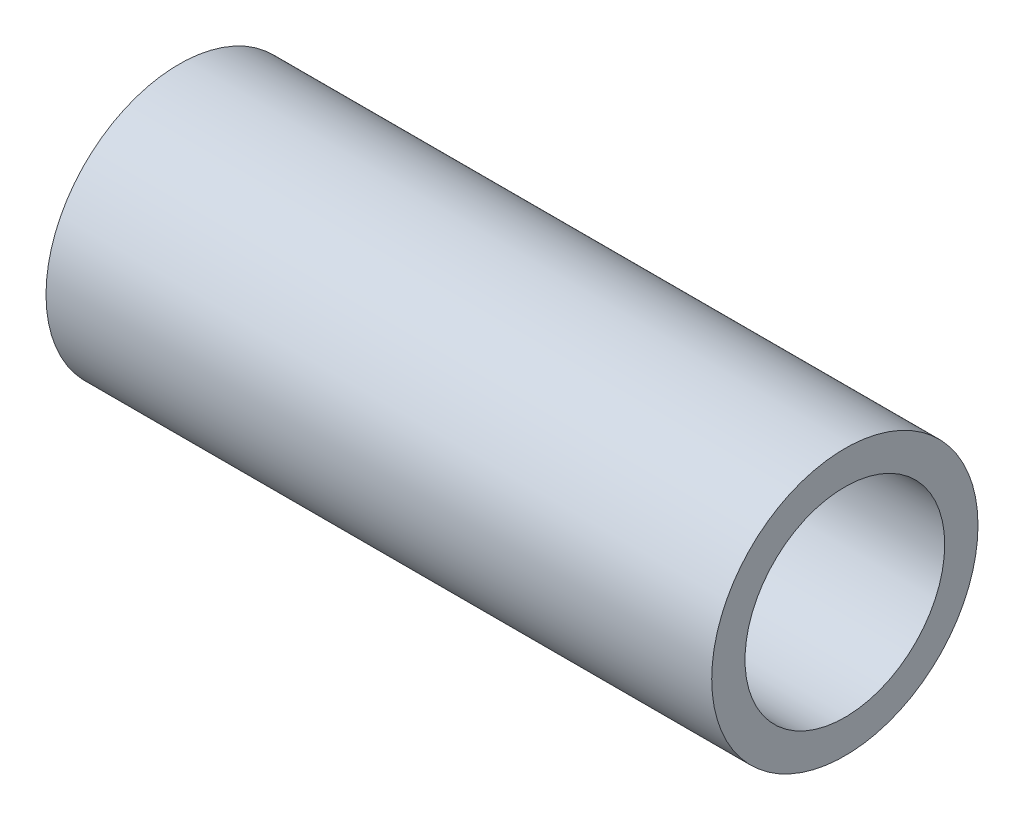
from build123d import *

# Parameters (mm, degrees)
SKETCH1_R           = 6.35
SKETCH1_R_2         = 4.7625
BOSS_EXTRUDE1_DEPTH = 15.875


with BuildPart() as part:
    # Sketch1 → Boss-Extrude1 (new, symmetric)
    with BuildSketch(Plane(origin=(0, 0, 0), x_dir=(0, 0, -1), z_dir=(1, 0, 0))):
        Circle(SKETCH1_R)
        Circle(SKETCH1_R_2, mode=Mode.SUBTRACT)
    extrude(amount=BOSS_EXTRUDE1_DEPTH, both=True)


solid = part.part
